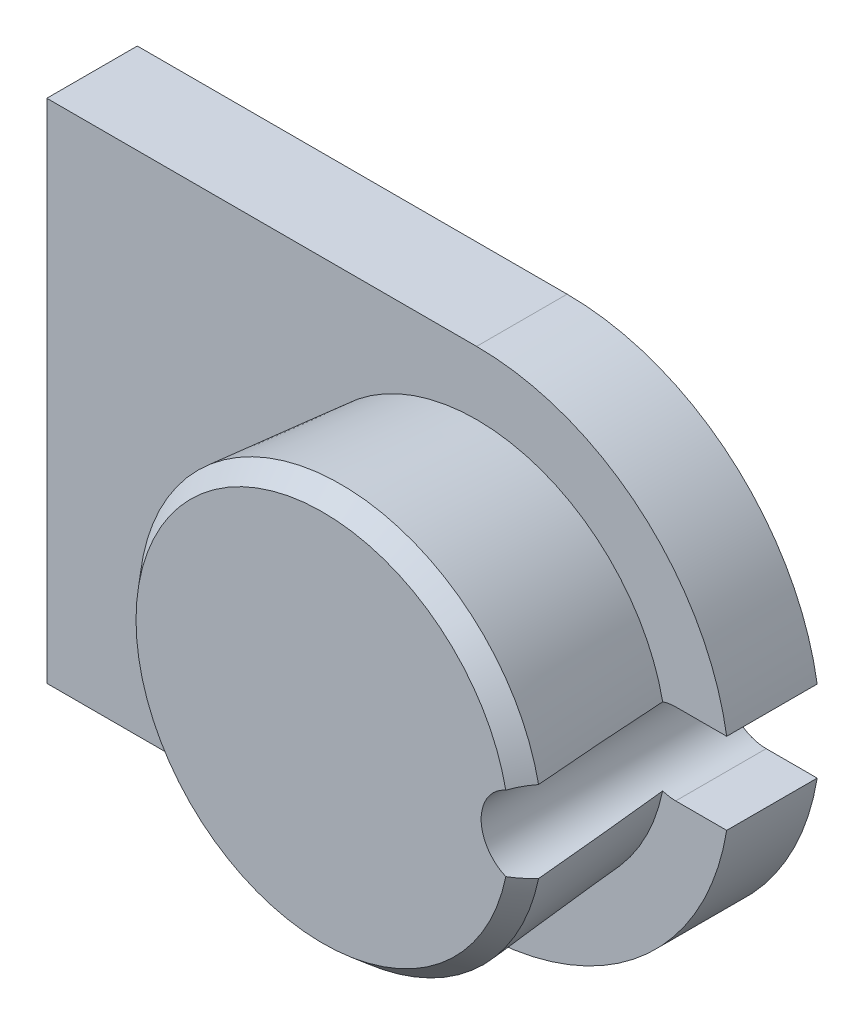
from build123d import *

# Parameters (mm, degrees)
AUFSATZ_LINEAR_AUSTRAGEN1_DEPTH      = 1
SKIZZE3_R                            = 2.1
AUFSATZ_LINEAR_AUSTRAGEN2_DEPTH      = 1.7
AUFSATZ_LINEAR_AUSTRAGEN2_DRAFT      = -5
FASE1_SIZE                           = 0.2
FASE1_SIZE2                          = 0.184612469
SCHNITT_LINEAR_AUSTRAGEN1_DEPTH      = 72.13241174
SCHNITT_LINEAR_AUSTRAGEN1_DEPTH_BACK = 72.13241174


with BuildPart() as part:
    # Skizze2 → Aufsatz-Linear austragen1 (new body)
    with BuildSketch(Plane.XY.offset(4.2)):
        with BuildLine():
            Line((60.75, 19.8), (65.5, 19.8))
            ThreePointArc((65.5, 19.8), (68.3, 17), (65.5, 14.2))
            Line((65.5, 14.2), (60.75, 14.2))
            Line((60.75, 14.2), (60.75, 19.8))
        make_face()
    extrude(amount=-AUFSATZ_LINEAR_AUSTRAGEN1_DEPTH)


with BuildPart() as aufsatz_linear_austragen2_tool:
    # Skizze3 → Aufsatz-Linear austragen2 (with draft: the straight prism first)
    with BuildSketch(Plane.XY.offset(4.2)):
        with Locations((65.5, 17)):
            Circle(SKIZZE3_R)
    extrude(amount=AUFSATZ_LINEAR_AUSTRAGEN2_DEPTH)
    # Aufsatz-Linear austragen2: the draft: its side faces are tilted about the plane it starts from
    aufsatz_linear_austragen2_sides = [aufsatz_linear_austragen2_tool.faces().sort_by_distance(p)[0] for p in [
        (63.4, 17, 5.05),
    ]]
    draft(aufsatz_linear_austragen2_sides, Plane.XY.offset(4.2), AUFSATZ_LINEAR_AUSTRAGEN2_DRAFT)


with BuildPart() as part_1:
    add(part.part)

    # Aufsatz-Linear austragen2: add aufsatz_linear_austragen2_tool
    add(aufsatz_linear_austragen2_tool.part)

    # Fase1
    fase1_edges = [part_1.edges().sort_by_distance(p)[0] for p in [
        (63.251269272, 17, 5.9),
    ]]
    fase1_side = [part_1.faces().sort_by_distance(p)[0] for p in [
        (63.325634636, 17, 5.05),
    ]]
    chamfer(fase1_edges, length=FASE1_SIZE, length2=FASE1_SIZE2, reference=fase1_side[0])

    # Skizze4 → Schnitt-Linear austragen1 (cut, two sides: drawn at the far end of the back side and taken through both)
    with BuildSketch(Plane.XY.offset(4.2).offset(-SCHNITT_LINEAR_AUSTRAGEN1_DEPTH_BACK)):
        with BuildLine():
            Line((69.324585046, 16.55), (67.7, 16.55))
            ThreePointArc((67.7, 16.55), (67.25, 17), (67.7, 17.45))
            Line((67.7, 17.45), (69.324585046, 17.45))
            ThreePointArc((69.324585046, 17.45), (69.774585046, 17), (69.324585046, 16.55))
        make_face()
    extrude(amount=SCHNITT_LINEAR_AUSTRAGEN1_DEPTH + SCHNITT_LINEAR_AUSTRAGEN1_DEPTH_BACK, mode=Mode.SUBTRACT)


solid = part_1.part
